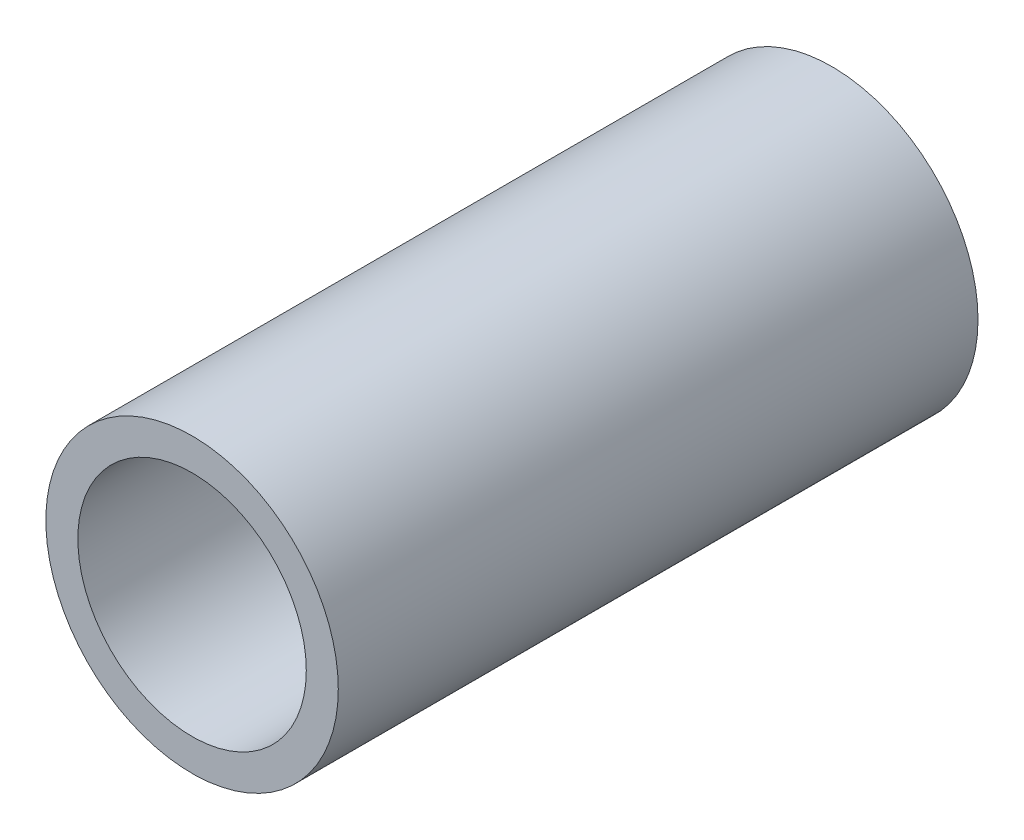
from build123d import *

# Parameters (mm, degrees)
CROQUIS1_R              = 16
SALIENTE_EXTRUIR1_DEPTH = 70
CROQUIS2_R              = 12.5
CORTAR_EXTRUIR1_DEPTH   = 69


with BuildPart() as part:
    # Croquis1 → Saliente-Extruir1 (new body)
    with BuildSketch(Plane.XY):
        Circle(CROQUIS1_R)
    extrude(amount=SALIENTE_EXTRUIR1_DEPTH)

    # Croquis2 → Cortar-Extruir1 (cut)
    with BuildSketch(Plane.XY.offset(70)):
        Circle(CROQUIS2_R)
    extrude(amount=-CORTAR_EXTRUIR1_DEPTH, mode=Mode.SUBTRACT)


solid = part.part
